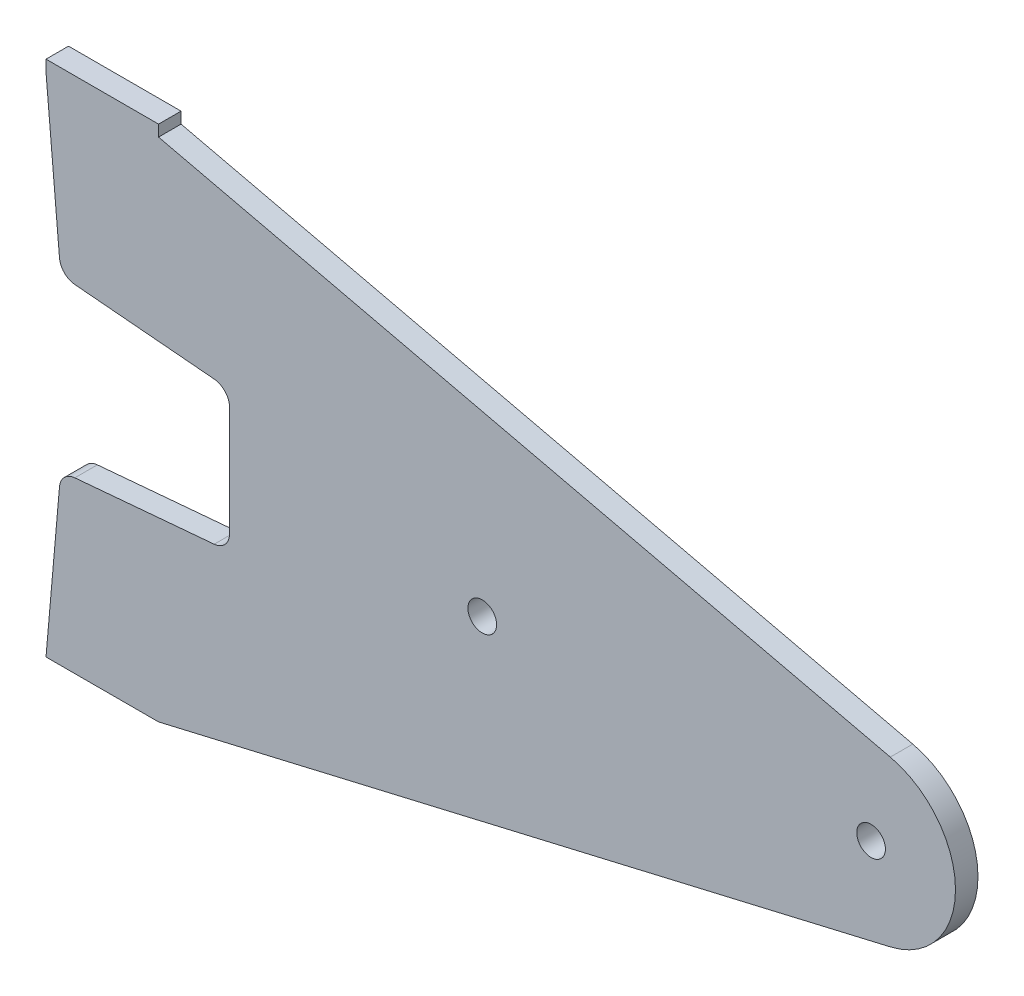
from build123d import *

# Parameters (mm, degrees)
SKETCH1_R           = 2.55
BOSS_EXTRUDE1_DEPTH = 4


with BuildPart() as part:
    # Sketch1 → Boss-Extrude1 (new body)
    with BuildSketch(Plane.XY):
        with BuildLine():
            Line((14.872885109, 17.599965411), (12.706250758, 42.361500851))
            Line((12.706250758, 42.361500851), (12.474619372, 45.008716695))
            Line((12.474619372, 45.008716695), (12.474619372, 47))
            Line((12.474619372, 47), (32.474619372, 47))
            Line((32.474619372, 47), (32.474619372, 45))
            Line((32.474619372, 45), (162.509181482, 14.606317485))
            ThreePointArc((162.509181482, 14.606317485), (174.095167783, 0), (162.509181482, -14.606317485))
            Line((162.509181482, -14.606317485), (32.474619372, -45))
            Line((32.474619372, -45), (12.474619372, -45.008716695))
            Line((12.474619372, -45.008716695), (12.706250758, -42.361500851))
            Line((12.706250758, -42.361500851), (14.872885109, -17.599965411))
            ThreePointArc((14.872885109, -17.599965411), (15.740145918, -15.740145918), (17.599965411, -14.872885109))
            Line((17.599965411, -14.872885109), (42.361500851, -12.706250758))
            ThreePointArc((42.361500851, -12.706250758), (44.311843411, -11.744427787), (45.1, -9.717669606))
            Line((45.1, -9.717669606), (45.1, 9.717669606))
            ThreePointArc((45.1, 9.717669606), (44.311843411, 11.744427787), (42.361500851, 12.706250758))
            Line((42.361500851, 12.706250758), (17.599965411, 14.872885109))
            ThreePointArc((17.599965411, 14.872885109), (15.740145918, 15.740145918), (14.872885109, 17.599965411))
        make_face()
        with Locations((159.095167783, 0)):
            Circle(SKETCH1_R, mode=Mode.SUBTRACT)
        with Locations((90, 0)):
            Circle(SKETCH1_R, mode=Mode.SUBTRACT)
    extrude(amount=BOSS_EXTRUDE1_DEPTH)


solid = part.part
